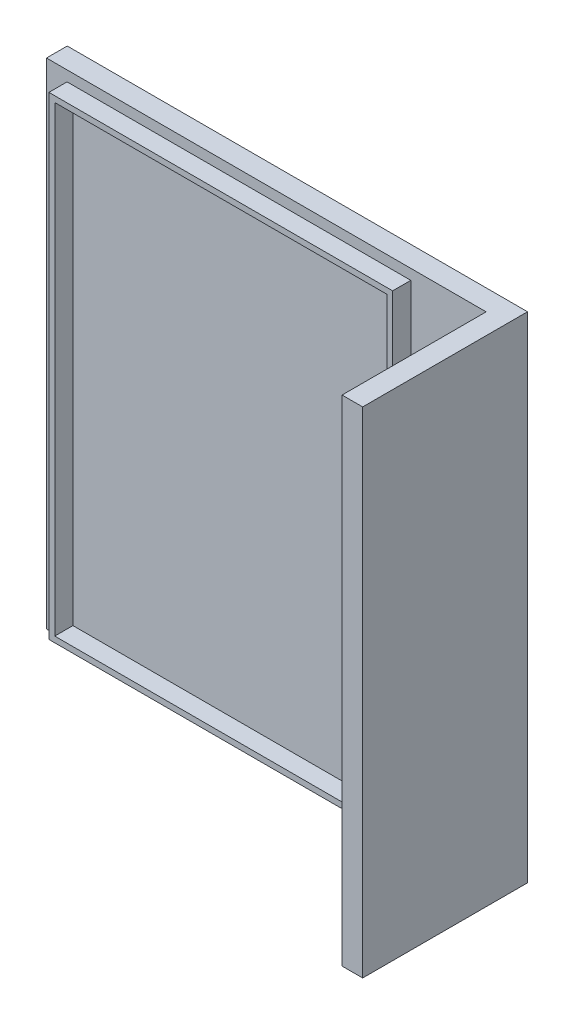
from build123d import *

# Parameters (mm, degrees)
SKETCH1_W           = 33.8709
SKETCH1_H           = 38.1
BOSS_EXTRUDE1_DEPTH = 1.599999848
SKETCH2_W           = 26.4795
SKETCH2_H           = 36.4998
SKETCH2_W_2         = 25.5795
SKETCH2_H_2         = 35.5998
BOSS_EXTRUDE2_DEPTH = 1.4
SKETCH3_W           = 12.7
SKETCH3_H           = 38.1
BOSS_EXTRUDE3_DEPTH = 1.5875


with BuildPart() as part:
    # Sketch1 → Boss-Extrude1 (new body)
    with BuildSketch(Plane.XY):
        Rectangle(SKETCH1_W, SKETCH1_H)
    extrude(amount=BOSS_EXTRUDE1_DEPTH)

    # Sketch2 → Boss-Extrude2 (add)
    with BuildSketch(Plane.XY.offset(1.599999848)):
        with Locations((-2.1082, 0)):
            Rectangle(SKETCH2_W, SKETCH2_H)
        with Locations((-2.1082, 0)):
            Rectangle(SKETCH2_W_2, SKETCH2_H_2, mode=Mode.SUBTRACT)
    extrude(amount=BOSS_EXTRUDE2_DEPTH)

    # Sketch3 → Boss-Extrude3 (add)
    with BuildSketch(Plane(origin=(16.93545, 0, 0), x_dir=(0, 0, -1), z_dir=(1, 0, 0))):
        with Locations((-6.35, 0)):
            Rectangle(SKETCH3_W, SKETCH3_H)
    extrude(amount=BOSS_EXTRUDE3_DEPTH)


solid = part.part
